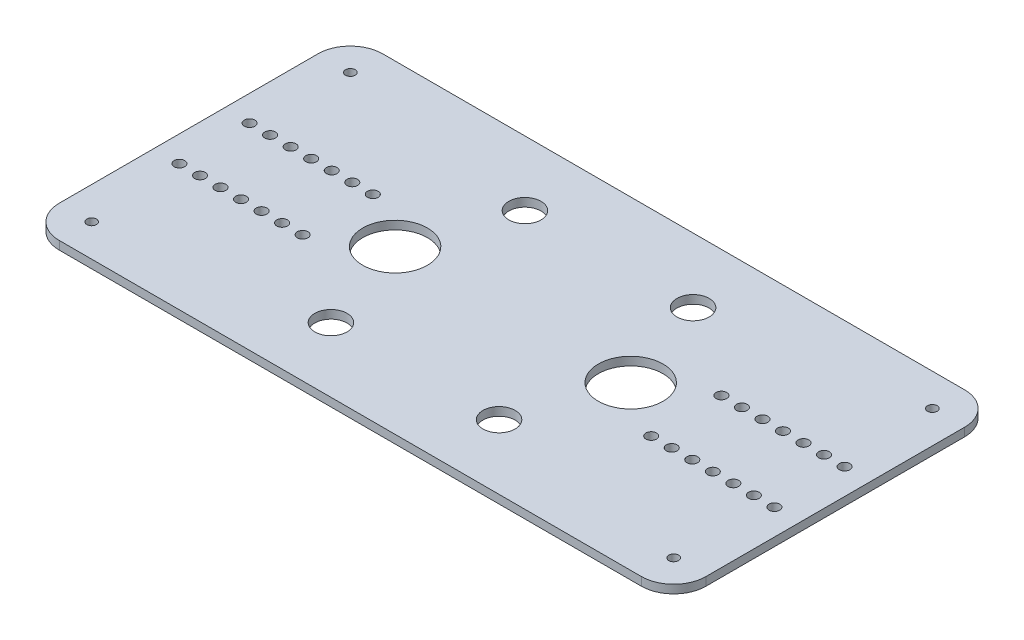
from build123d import *

# Parameters (mm, degrees)
SKETCH1_W               = 200
SKETCH1_H               = 100
BOSS_EXTRUDE1_DEPTH     = 2.6
FILLET1_R               = 10
SKETCH8_R               = 1.65
CUT_EXTRUDE4_DEPTH      = 2.6
LPATTERN1_COUNT         = 7
LPATTERN1_PITCH         = 6.35
MIRROR1_COPY_1_SKETCH_R = 1.65
MIRROR1_COPY_1_DEPTH    = 2.6
MIRROR1_COPY_2_SKETCH_R = 1.65
MIRROR1_COPY_2_DEPTH    = 2.6
MIRROR1_COPY_3_SKETCH_R = 1.65
MIRROR1_COPY_3_DEPTH    = 2.6
MIRROR1_COPY_4_SKETCH_R = 1.65
MIRROR1_COPY_4_DEPTH    = 2.6
MIRROR1_COPY_5_SKETCH_R = 1.65
MIRROR1_COPY_5_DEPTH    = 2.6
MIRROR1_COPY_6_SKETCH_R = 1.65
MIRROR1_COPY_6_DEPTH    = 2.6
SKETCH6_R               = 1.5
CUT_EXTRUDE6_DEPTH      = 2.6
MIRROR6_COPY_1_SKETCH_R = 1.5
MIRROR6_COPY_1_DEPTH    = 2.6
SKETCH13_R              = 4.980627928
CUT_EXTRUDE7_DEPTH      = 2.6
MIRROR8_COPY_1_SKETCH_R = 4.980627928
MIRROR8_COPY_1_DEPTH    = 2.6
SKETCH15_R              = 10
CUT_EXTRUDE8_DEPTH      = 2.6


with BuildPart() as part:
    # Sketch1 → Boss-Extrude1 (new body)
    with BuildSketch(Plane(origin=(0, 0, 0), x_dir=(1, 0, 0), z_dir=(0, 1, 0))):
        with Locations((100, -50)):
            Rectangle(SKETCH1_W, SKETCH1_H)
    extrude(amount=BOSS_EXTRUDE1_DEPTH)

    # Fillet1
    fillet1_edges = [part.edges().sort_by_distance(p)[0] for p in [
        (0, 1.3, 0),
        (200, 1.3, 0),
        (200, 1.3, 100),
        (0, 1.3, 100),
    ]]
    fillet(fillet1_edges, radius=FILLET1_R)

    # Sketch8 → Cut-Extrude4 (cut)
    with BuildSketch(Plane.XZ):
        with Locations(Location((192, 60.85, 0), (0, 0, 270))):
            Circle(SKETCH8_R)
        with Locations(Location((192, 39.15, 0), (0, 0, 270))):
            Circle(SKETCH8_R)
    cut_extrude4 = extrude(amount=-CUT_EXTRUDE4_DEPTH, mode=Mode.SUBTRACT)

    # LPattern1: Cut-Extrude4 ×7
    with Locations(*[(-i * LPATTERN1_PITCH, 0, 0) for i in range(1, LPATTERN1_COUNT)]):
        add(cut_extrude4, mode=Mode.SUBTRACT)

    # Mirror1: Cut-Extrude4 across plane
    add(cut_extrude4.mirror(Plane(origin=(100, 0, 0), x_dir=(0, 0, 1), z_dir=(1, 0, 0))), mode=Mode.SUBTRACT)

    # Mirror1 copy 1 sketch → Mirror1 copy 1 (cut)
    with BuildSketch(Plane(origin=(206.35, 0, 0), x_dir=(-1, 0, 0), z_dir=(0, -1, 0))):
        with Locations((192, -60.85)):
            Circle(MIRROR1_COPY_1_SKETCH_R)
        with Locations((192, -39.15)):
            Circle(MIRROR1_COPY_1_SKETCH_R)
    extrude(amount=-MIRROR1_COPY_1_DEPTH, mode=Mode.SUBTRACT)

    # Mirror1 copy 2 sketch → Mirror1 copy 2 (cut)
    with BuildSketch(Plane(origin=(212.7, 0, 0), x_dir=(-1, 0, 0), z_dir=(0, -1, 0))):
        with Locations((192, -60.85)):
            Circle(MIRROR1_COPY_2_SKETCH_R)
        with Locations((192, -39.15)):
            Circle(MIRROR1_COPY_2_SKETCH_R)
    extrude(amount=-MIRROR1_COPY_2_DEPTH, mode=Mode.SUBTRACT)

    # Mirror1 copy 3 sketch → Mirror1 copy 3 (cut)
    with BuildSketch(Plane(origin=(219.05, 0, 0), x_dir=(-1, 0, 0), z_dir=(0, -1, 0))):
        with Locations((192, -60.85)):
            Circle(MIRROR1_COPY_3_SKETCH_R)
        with Locations((192, -39.15)):
            Circle(MIRROR1_COPY_3_SKETCH_R)
    extrude(amount=-MIRROR1_COPY_3_DEPTH, mode=Mode.SUBTRACT)

    # Mirror1 copy 4 sketch → Mirror1 copy 4 (cut)
    with BuildSketch(Plane(origin=(225.4, 0, 0), x_dir=(-1, 0, 0), z_dir=(0, -1, 0))):
        with Locations((192, -60.85)):
            Circle(MIRROR1_COPY_4_SKETCH_R)
        with Locations((192, -39.15)):
            Circle(MIRROR1_COPY_4_SKETCH_R)
    extrude(amount=-MIRROR1_COPY_4_DEPTH, mode=Mode.SUBTRACT)

    # Mirror1 copy 5 sketch → Mirror1 copy 5 (cut)
    with BuildSketch(Plane(origin=(231.75, 0, 0), x_dir=(-1, 0, 0), z_dir=(0, -1, 0))):
        with Locations((192, -60.85)):
            Circle(MIRROR1_COPY_5_SKETCH_R)
        with Locations((192, -39.15)):
            Circle(MIRROR1_COPY_5_SKETCH_R)
    extrude(amount=-MIRROR1_COPY_5_DEPTH, mode=Mode.SUBTRACT)

    # Mirror1 copy 6 sketch → Mirror1 copy 6 (cut)
    with BuildSketch(Plane(origin=(238.1, 0, 0), x_dir=(-1, 0, 0), z_dir=(0, -1, 0))):
        with Locations((192, -60.85)):
            Circle(MIRROR1_COPY_6_SKETCH_R)
        with Locations((192, -39.15)):
            Circle(MIRROR1_COPY_6_SKETCH_R)
    extrude(amount=-MIRROR1_COPY_6_DEPTH, mode=Mode.SUBTRACT)

    # Sketch6 → Cut-Extrude6 (cut)
    with BuildSketch(Plane.XZ):
        with Locations(Location((190, 10, 0), (0, 0, 270))):
            Circle(SKETCH6_R)
    cut_extrude6 = extrude(amount=-CUT_EXTRUDE6_DEPTH, mode=Mode.SUBTRACT)

    # Mirror5: Cut-Extrude6 across plane
    add(cut_extrude6.mirror(Plane(origin=(100, 0, 0), x_dir=(0, 0, 1), z_dir=(1, 0, 0))), mode=Mode.SUBTRACT)

    # Mirror6: Cut-Extrude6 across plane
    add(cut_extrude6.mirror(Plane.XY.offset(50)), mode=Mode.SUBTRACT)

    # Mirror6 copy 1 sketch → Mirror6 copy 1 (cut)
    with BuildSketch(Plane(origin=(200, 0, 100), x_dir=(-1, 0, 0), z_dir=(0, -1, 0))):
        with Locations(Location((190, 10, 0), (0, 0, 270))):
            Circle(MIRROR6_COPY_1_SKETCH_R)
    extrude(amount=-MIRROR6_COPY_1_DEPTH, mode=Mode.SUBTRACT)

    # Sketch13 → Cut-Extrude7 (cut)
    with BuildSketch(Plane(origin=(0, 2.6, 0), x_dir=(1, 0, 0), z_dir=(0, 1, 0))):
        with Locations(Location((74, -80, 0), (0, 0, 270))):
            Circle(SKETCH13_R)
    cut_extrude7 = extrude(amount=-CUT_EXTRUDE7_DEPTH, mode=Mode.SUBTRACT)

    # Mirror7: Cut-Extrude7 across plane
    add(cut_extrude7.mirror(Plane.XY.offset(50)), mode=Mode.SUBTRACT)

    # Mirror8: Cut-Extrude7 across plane
    add(cut_extrude7.mirror(Plane(origin=(100, 0, 0), x_dir=(0, 0, 1), z_dir=(1, 0, 0))), mode=Mode.SUBTRACT)

    # Mirror8 copy 1 sketch → Mirror8 copy 1 (cut)
    with BuildSketch(Plane(origin=(200, 2.6, 100), x_dir=(-1, 0, 0), z_dir=(0, 1, 0))):
        with Locations(Location((74, -80, 0), (0, 0, 270))):
            Circle(MIRROR8_COPY_1_SKETCH_R)
    extrude(amount=-MIRROR8_COPY_1_DEPTH, mode=Mode.SUBTRACT)

    # Sketch15 → Cut-Extrude8 (cut)
    with BuildSketch(Plane.XZ):
        with Locations(Location((63.571852265, 49.722041857, 0), (0, 0, 270))):
            Circle(SKETCH15_R)
    cut_extrude8 = extrude(amount=-CUT_EXTRUDE8_DEPTH, mode=Mode.SUBTRACT)

    # Mirror9: Cut-Extrude8 across plane
    add(cut_extrude8.mirror(Plane(origin=(100, 0, 0), x_dir=(0, 0, 1), z_dir=(1, 0, 0))), mode=Mode.SUBTRACT)


solid = part.part
